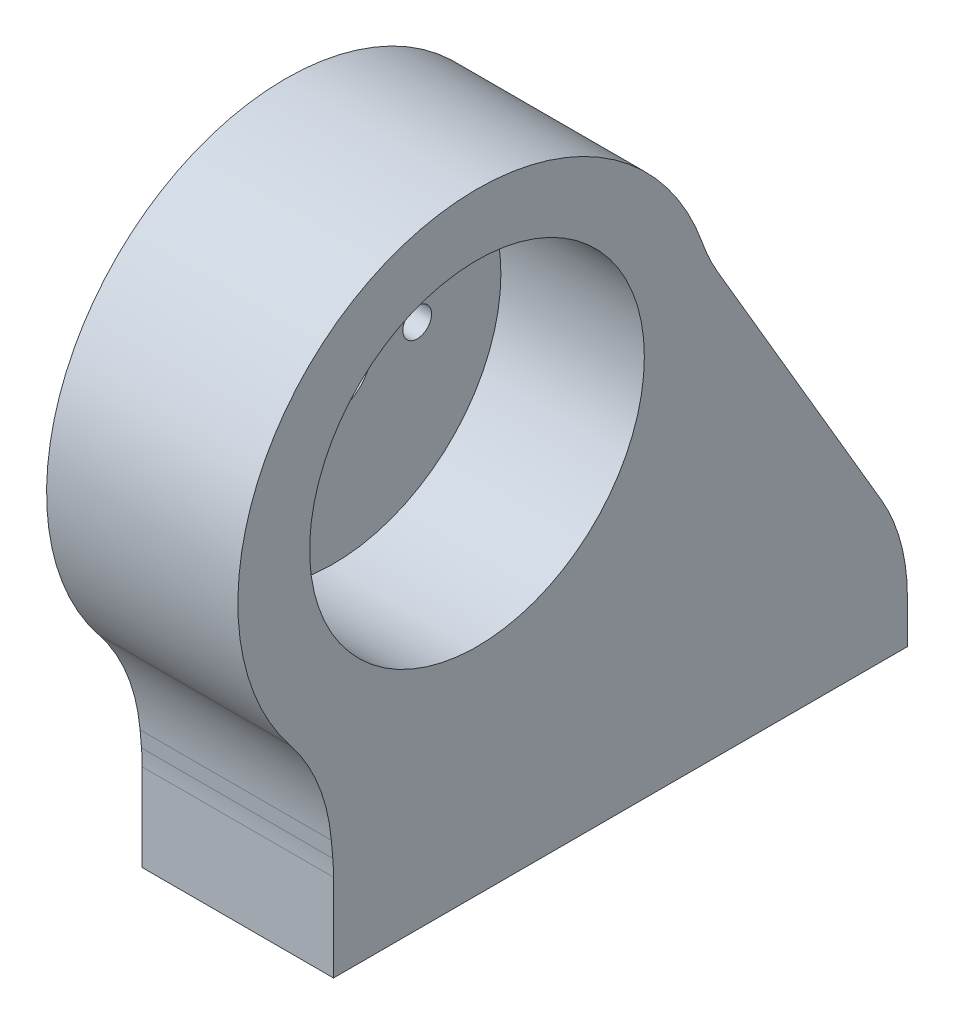
from build123d import *

# Parameters (mm, degrees)
SALIENTE_EXTRUIR1_DEPTH = 20
CROQUIS5_R              = 17.5
CORTAR_EXTRUIR1_DEPTH   = 15
CROQUIS6_R              = 4
CROQUIS6_R_2            = 1.5
CORTAR_EXTRUIR2_DEPTH   = 6
CROQUIS7_R              = 3
CORTAR_EXTRUIR3_DEPTH   = 2


with BuildPart() as part:
    # Croquis3 → Saliente-Extruir1 (new body)
    with BuildSketch(Plane(origin=(0, 0, 0), x_dir=(0, 0, -1), z_dir=(1, 0, 0))):
        with BuildLine():
            Line((27.255557931, 9.68339194), (10.161648688, 38.854157713))
            ThreePointArc((10.161648688, 38.854157713), (9.28194474, 40.533010779), (8.565114788, 42.287599469))
            ThreePointArc((8.565114788, 42.287599469), (-27.147634239, 55.790109054), (-34.527859081, 18.330123878))
            ThreePointArc((-34.527859081, 18.330123878), (-31.582921761, 13.275948256), (-30.226287359, 7.585878825))
            Line((-30.226287359, 7.585878825), (-30.076141014, 5.870094713))
            ThreePointArc((-30.076141014, 5.870094713), (-30.019044321, 4.999168316), (-30, 4.126580134))
            Line((-30, 4.126580134), (-30, -5))
            Line((-30, -5), (30, -5))
            Line((30, -5), (30, -0.428270658))
            ThreePointArc((30, -0.428270658), (29.301698871, 4.810471624), (27.255557931, 9.68339194))
        make_face()
    extrude(amount=-SALIENTE_EXTRUIR1_DEPTH)

    # Croquis5 → Cortar-Extruir1 (cut)
    with BuildSketch(Plane(origin=(0, 0, 0), x_dir=(0, 0, -1), z_dir=(1, 0, 0))):
        with Locations((-15, 35)):
            Circle(CROQUIS5_R)
    extrude(amount=-CORTAR_EXTRUIR1_DEPTH, mode=Mode.SUBTRACT)

    # Croquis6 → Cortar-Extruir2 (cut)
    with BuildSketch(Plane(origin=(-15, 0, 0), x_dir=(0, 0, -1), z_dir=(1, 0, 0))):
        with Locations((-15, 35)):
            Circle(CROQUIS6_R)
        with Locations((-6.25, 35)):
            Circle(CROQUIS6_R_2)
        with Locations((-23.75, 35)):
            Circle(CROQUIS6_R_2)
    extrude(amount=-CORTAR_EXTRUIR2_DEPTH, mode=Mode.SUBTRACT)

    # Croquis7 → Cortar-Extruir3 (cut)
    with BuildSketch(Plane.ZY.offset(20)):
        with Locations((6.25, 35)):
            Circle(CROQUIS7_R)
        with Locations((23.75, 35)):
            Circle(CROQUIS7_R)
    extrude(amount=-CORTAR_EXTRUIR3_DEPTH, mode=Mode.SUBTRACT)


solid = part.part
